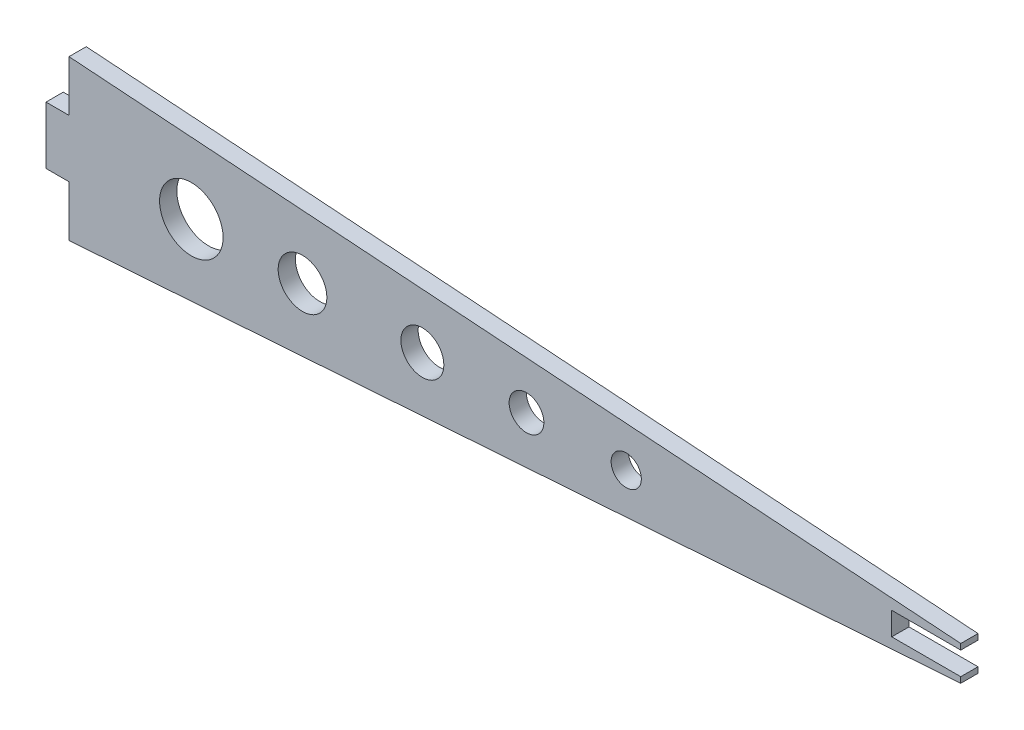
from build123d import *

# Parameters (mm, degrees)
MODEL_R         = 2.761626555
MODEL_R_2       = 1.866571664
MODEL_R_3       = 1.313234148
MODEL_R_4       = 2.116722719
MODEL_R_5       = 1.509742993
EXTRUDE_1_DEPTH = 1.5


with BuildPart() as part:
    # Model → 凸台-拉伸1 (new body)
    with BuildSketch(Plane.XY):
        Polygon((244.059423642, -194.252615776), (166.526919178, -199.674216635), (166.526919178, -195.252615776), (164.526919178, -195.252615776), (164.526919178, -190.252615776), (166.526919178, -190.252615776), (166.526919178, -185.831017216), (244.059416516, -191.252615776), (244.059417704, -191.752615776), (238.059420079, -191.752615776), (238.059420079, -192.752615776), (238.059420079, -193.752615776), (244.059422454, -193.752615776), align=None)
        with Locations((177.162967315, -192.752615776)):
            Circle(MODEL_R, mode=Mode.SUBTRACT)
        with Locations((197.250125118, -192.752615776)):
            Circle(MODEL_R_2, mode=Mode.SUBTRACT)
        with Locations((214.974129703, -192.752615776)):
            Circle(MODEL_R_3, mode=Mode.SUBTRACT)
        with Locations((186.829055112, -192.752615776)):
            Circle(MODEL_R_4, mode=Mode.SUBTRACT)
        with Locations((206.302954902, -192.752615776)):
            Circle(MODEL_R_5, mode=Mode.SUBTRACT)
    extrude(amount=EXTRUDE_1_DEPTH)


solid = part.part
